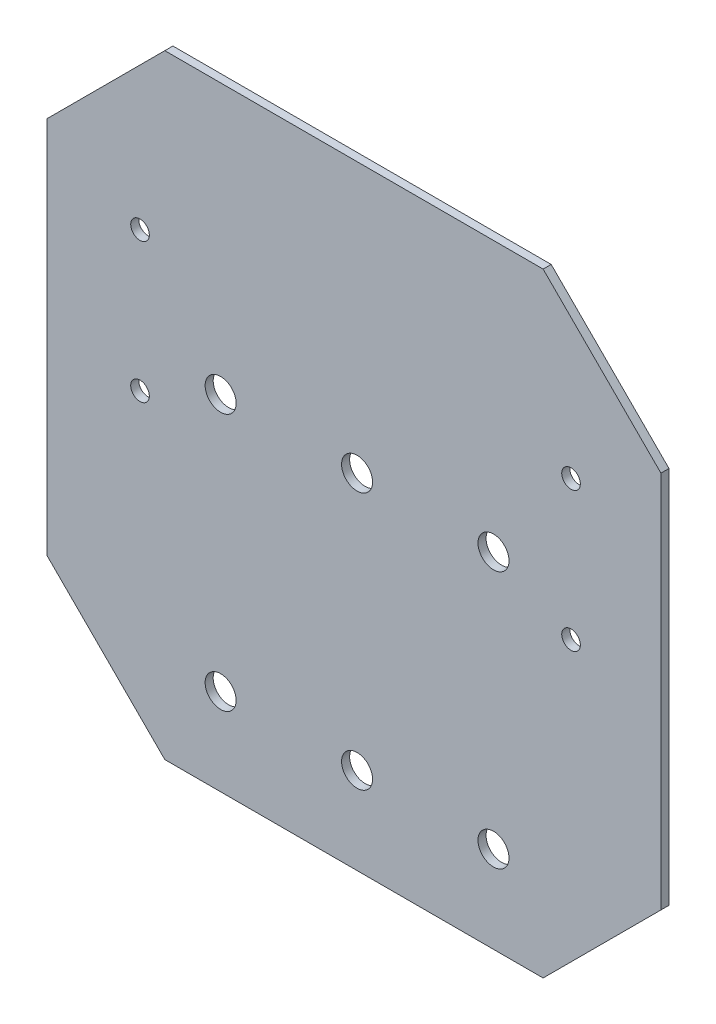
from build123d import *

# Parameters (mm, degrees)
SKETCH1_R           = 2.5
SKETCH1_R_2         = 1.5
BOSS_EXTRUDE1_DEPTH = 1.3


with BuildPart() as part:
    # Sketch1 → Boss-Extrude1 (new body)
    with BuildSketch(Plane.XY):
        Polygon((-34.175323676, 43.186140305), (-34.175323676, -17.813859695), (-15.175323676, -36.813859695), (45.824676324, -36.813859695), (64.824676324, -17.813859695), (64.824676324, 43.186140305), (45.824676324, 62.186140305), (-15.175323676, 62.186140305), align=None)
        with Locations((-6.175323676, 18.686140305)):
            Circle(SKETCH1_R, mode=Mode.SUBTRACT)
        with Locations((15.824676324, 18.686140305)):
            Circle(SKETCH1_R, mode=Mode.SUBTRACT)
        with Locations((37.824676324, 18.686140305)):
            Circle(SKETCH1_R, mode=Mode.SUBTRACT)
        with Locations((15.824676324, -22.813859695)):
            Circle(SKETCH1_R, mode=Mode.SUBTRACT)
        with Locations((37.824676324, -22.813859695)):
            Circle(SKETCH1_R, mode=Mode.SUBTRACT)
        with Locations((-6.175323676, -22.813859695)):
            Circle(SKETCH1_R, mode=Mode.SUBTRACT)
        with Locations((-19.175323676, 12.686140305)):
            Circle(SKETCH1_R_2, mode=Mode.SUBTRACT)
        with Locations((-19.175323676, 35.186140305)):
            Circle(SKETCH1_R_2, mode=Mode.SUBTRACT)
        with Locations((50.324676324, 35.186140305)):
            Circle(SKETCH1_R_2, mode=Mode.SUBTRACT)
        with Locations((50.324676324, 12.686140305)):
            Circle(SKETCH1_R_2, mode=Mode.SUBTRACT)
    extrude(amount=BOSS_EXTRUDE1_DEPTH)


solid = part.part
